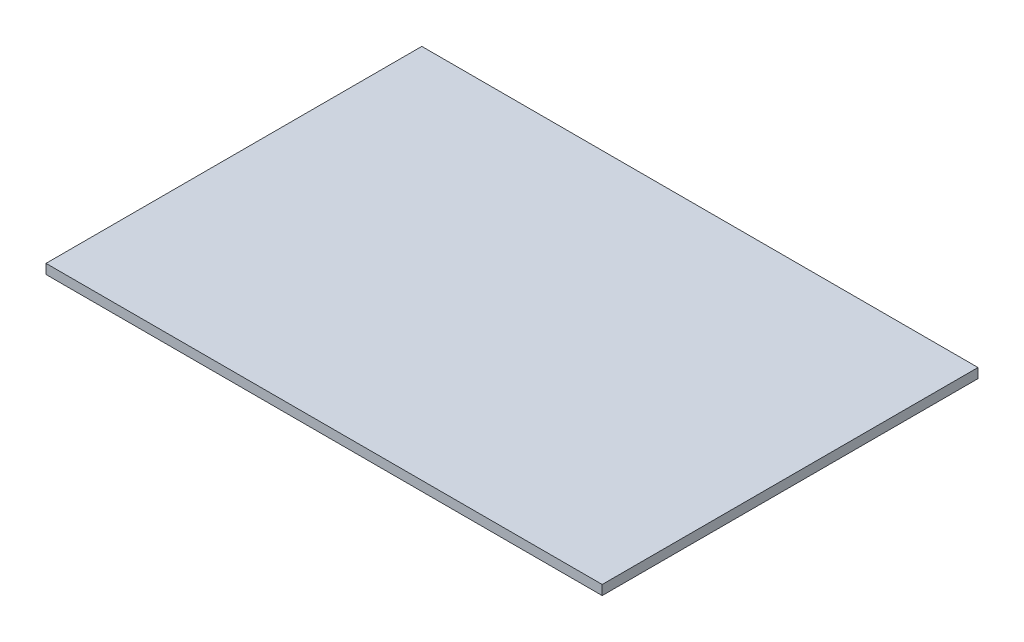
from build123d import *

# Parameters (mm, degrees)
ESQUISSE1_W        = 1036
ESQUISSE1_H        = 700
BOSS_EXTRU_1_DEPTH = 18


with BuildPart() as part:
    # Esquisse1 → Boss.-Extru.1 (new body)
    with BuildSketch(Plane(origin=(0, 0, 0), x_dir=(1, 0, 0), z_dir=(0, 1, 0))):
        Rectangle(ESQUISSE1_W, ESQUISSE1_H)
    extrude(amount=BOSS_EXTRU_1_DEPTH)


solid = part.part
